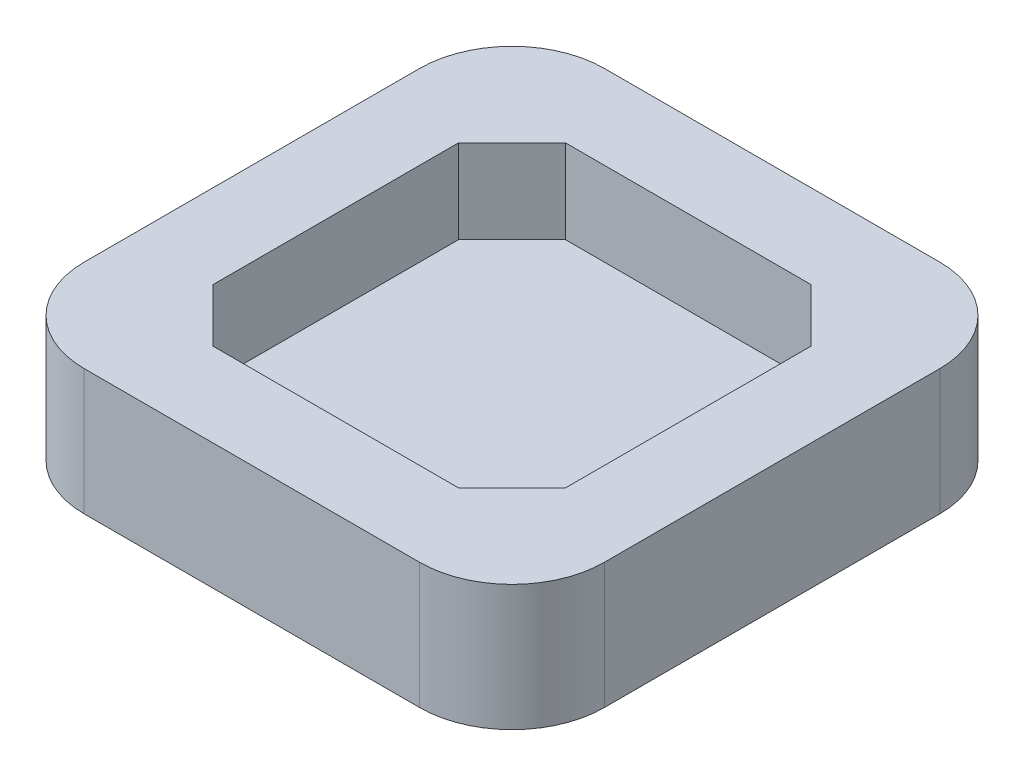
from build123d import *

# Parameters (mm, degrees)
SKETCH1_W           = 62
SKETCH1_H           = 62
SKETCH1_W_2         = 42
SKETCH1_H_2         = 42
BOSS_EXTRUDE1_DEPTH = 10
SKETCH2_W           = 62
SKETCH2_H           = 62
BOSS_EXTRUDE2_DEPTH = 5
FILLET1_R           = 11


with BuildPart() as part:
    # Sketch1 → Boss-Extrude1 (new body)
    # profile 1 of 5: a face of its own
    with BuildSketch(Plane(origin=(0, 0, 0), x_dir=(1, 0, 0), z_dir=(0, 1, 0))):
        Rectangle(SKETCH1_W, SKETCH1_H)
        Rectangle(SKETCH1_W_2, SKETCH1_H_2, mode=Mode.SUBTRACT)
    # profile 2 of 5: a face of its own
    with BuildSketch(Plane(origin=(0, 0, 0), x_dir=(1, 0, 0), z_dir=(0, 1, 0))):
        Polygon((21, -21), (21, -14.636038969), (14.636038969, -21), align=None)
    # profile 3 of 5: a face of its own
    with BuildSketch(Plane(origin=(0, 0, 0), x_dir=(1, 0, 0), z_dir=(0, 1, 0))):
        Polygon((14.636038969, 21), (21, 14.636038969), (21, 21), align=None)
    # profile 4 of 5: a face of its own
    with BuildSketch(Plane(origin=(0, 0, 0), x_dir=(1, 0, 0), z_dir=(0, 1, 0))):
        Polygon((-21, 14.636038969), (-14.636038969, 21), (-21, 21), align=None)
    # profile 5 of 5: a face of its own
    with BuildSketch(Plane(origin=(0, 0, 0), x_dir=(1, 0, 0), z_dir=(0, 1, 0))):
        Polygon((-21, -21), (-14.636038969, -21), (-21, -14.636038969), align=None)
    extrude(amount=BOSS_EXTRUDE1_DEPTH)

    # Sketch2 → Boss-Extrude2 (add)
    with BuildSketch(Plane(origin=(0, 0, 0), x_dir=(-1, 0, 0), z_dir=(0, -1, 0))):
        Rectangle(SKETCH2_W, SKETCH2_H)
    extrude(amount=BOSS_EXTRUDE2_DEPTH)

    # Fillet1
    fillet1_edges = [part.edges().sort_by_distance(p)[0] for p in [
        (-31, 2.5, 31),
        (-31, 2.5, -31),
        (31, 2.5, -31),
        (31, 2.5, 31),
    ]]
    fillet(fillet1_edges, radius=FILLET1_R)


solid = part.part
